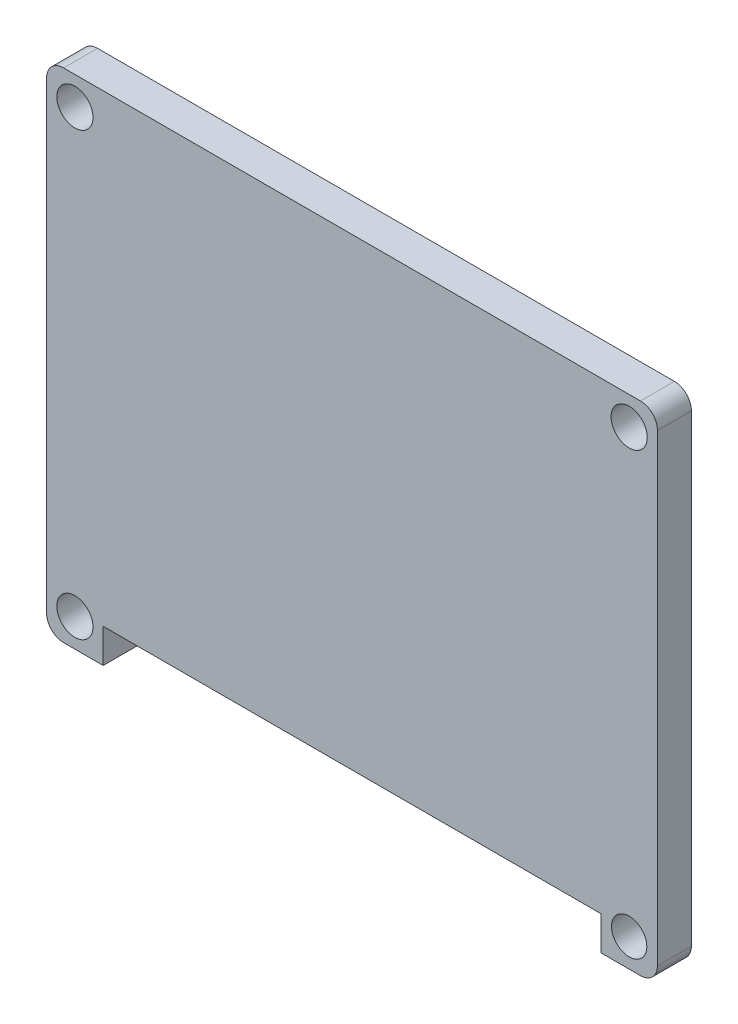
from build123d import *

# Parameters (mm, degrees)
SKETCH1_R           = 1.6
SKETCH1_R_2         = 1.559740896
BOSS_EXTRUDE1_DEPTH = 1.5


with BuildPart() as part:
    # Sketch1 → Boss-Extrude1 (new, symmetric)
    with BuildSketch(Plane.XY):
        with BuildLine():
            Line((22.828032498, -22.06376378), (21.828032498, -22.06376378))
            Line((21.828032498, -22.06376378), (21.828032498, -19.06376378))
            Line((21.828032498, -19.06376378), (-22.171967502, -19.06376378))
            Line((-22.171967502, -19.06376378), (-22.171967502, -22.06376378))
            Line((-22.171967502, -22.06376378), (-23.171967502, -22.06376378))
            Line((-23.171967502, -22.06376378), (-25.671967502, -22.06376378))
            ThreePointArc((-25.671967502, -22.06376378), (-26.732627674, -21.624423952), (-27.171967502, -20.56376378))
            Line((-27.171967502, -20.56376378), (-27.171967502, 20.43623622))
            ThreePointArc((-27.171967502, 20.43623622), (-26.732627674, 21.496896392), (-25.671967502, 21.93623622))
            Line((-25.671967502, 21.93623622), (25.328032498, 21.93623622))
            ThreePointArc((25.328032498, 21.93623622), (26.38869267, 21.496896392), (26.828032498, 20.43623622))
            Line((26.828032498, 20.43623622), (26.828032498, -20.56376378))
            ThreePointArc((26.828032498, -20.56376378), (26.38869267, -21.624423952), (25.328032498, -22.06376378))
            Line((25.328032498, -22.06376378), (22.828032498, -22.06376378))
        make_face()
        with Locations((-24.671967502, 19.43623622)):
            Circle(SKETCH1_R, mode=Mode.SUBTRACT)
        with Locations((24.328032498, 19.43623622)):
            Circle(SKETCH1_R, mode=Mode.SUBTRACT)
        with Locations((24.328032498, -19.56376378)):
            Circle(SKETCH1_R_2, mode=Mode.SUBTRACT)
        with Locations((-24.671967502, -19.56376378)):
            Circle(SKETCH1_R, mode=Mode.SUBTRACT)
    extrude(amount=BOSS_EXTRUDE1_DEPTH, both=True)


solid = part.part
